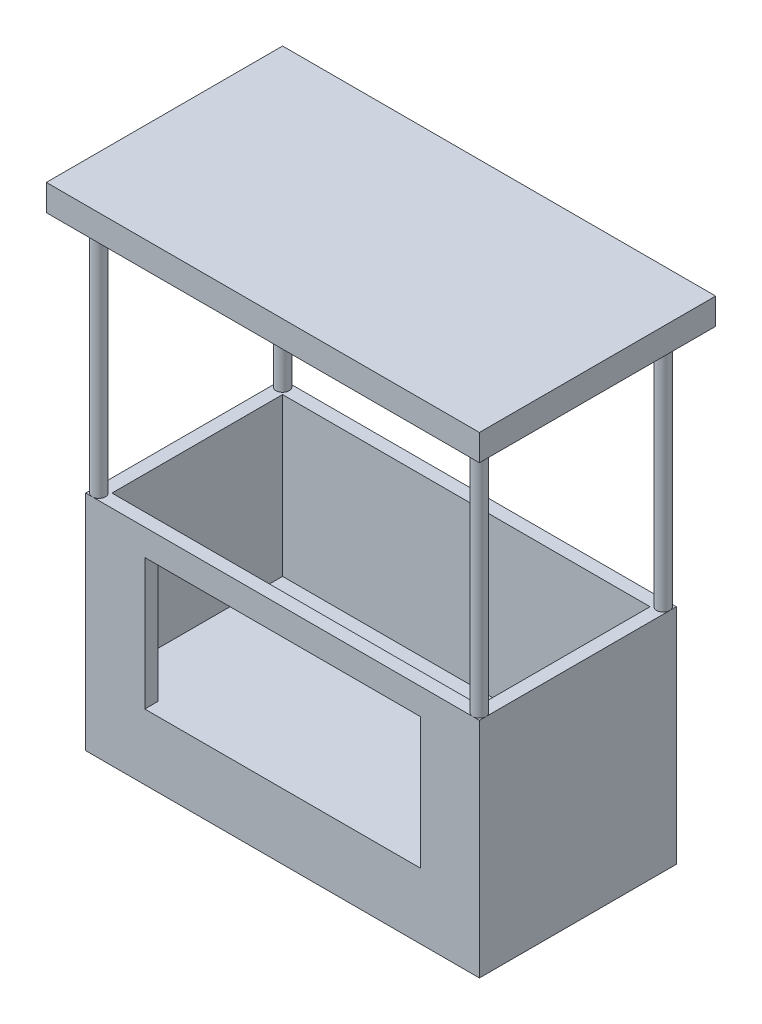
from build123d import *

# Parameters (mm, degrees)
SKETCH_1_W          = 60
SKETCH_1_H          = 30
EXTRUDE_1_DEPTH     = 10
EXTRUDE_2_DEPTH     = 20
SKETCH_3_W          = 60
SKETCH_3_H          = 30
SKETCH_3_W_2        = 56
SKETCH_3_H_2        = 26
EXTRUDE_3_DEPTH     = 4
SKETCH_4_R          = 1
EXTRUDE_4_DEPTH     = 37
SKETCH_5_W          = 66
SKETCH_5_H          = 36
EXTRUDE_5_DEPTH     = 4
CUT_EXTRUDE_1_REACH = 98.348
SKETCH_6_R          = 5


with BuildPart() as part:
    # 草图1 → 凸台-拉伸1 (new body)
    with BuildSketch(Plane(origin=(0, 0, 0), x_dir=(1, 0, 0), z_dir=(0, 1, 0))):
        with Locations((30, 15)):
            Rectangle(SKETCH_1_W, SKETCH_1_H)
    extrude(amount=EXTRUDE_1_DEPTH)

    # 草图2 → 凸台-拉伸2 (add)
    with BuildSketch(Plane(origin=(0, 10, 0), x_dir=(1, 0, 0), z_dir=(0, 1, 0))):
        Polygon((60, 0), (51, 0), (51, 2), (58, 2), (58, 28), (2, 28), (2, 2), (9, 2), (9, 0), (0, 0), (0, 30), (60, 30), align=None)
    extrude(amount=EXTRUDE_2_DEPTH)

    # 草图3 → 凸台-拉伸3 (add)
    with BuildSketch(Plane(origin=(0, 30, 0), x_dir=(1, 0, 0), z_dir=(0, 1, 0))):
        with Locations((30, 15)):
            Rectangle(SKETCH_3_W, SKETCH_3_H)
        with Locations((30, 15)):
            Rectangle(SKETCH_3_W_2, SKETCH_3_H_2, mode=Mode.SUBTRACT)
    extrude(amount=EXTRUDE_3_DEPTH)

    # 草图4 → 凸台-拉伸4 (add)
    with BuildSketch(Plane(origin=(0, 34, 0), x_dir=(1, 0, 0), z_dir=(0, 1, 0))):
        with Locations(Location((1, 29, 0), (0, 0, 90))):
            Circle(SKETCH_4_R)
        with Locations(Location((1, 1, 0), (0, 0, 270))):
            Circle(SKETCH_4_R)
        with Locations(Location((59, 29, 0), (0, 0, 90))):
            Circle(SKETCH_4_R)
        with Locations(Location((59, 1, 0), (0, 0, 270))):
            Circle(SKETCH_4_R)
    extrude(amount=EXTRUDE_4_DEPTH)

    # 草图5 → 凸台-拉伸5 (add)
    with BuildSketch(Plane(origin=(0, 71, 0), x_dir=(1, 0, 0), z_dir=(0, 1, 0))):
        with Locations((30, 15)):
            Rectangle(SKETCH_5_W, SKETCH_5_H)
    extrude(amount=EXTRUDE_5_DEPTH)

    # 草图6 → 切除-拉伸1 (cut, up to next)
    with BuildSketch(Plane(origin=(0, 10, 0), x_dir=(1, 0, 0), z_dir=(0, 1, 0)), mode=Mode.PRIVATE) as cut_extrude_1_sk1:
        with Locations(Location((52.583011954, 22.907401762, 0), (0, 0, 270))):
            Circle(SKETCH_6_R)
    cut_extrude_1_tool1 = extrude(cut_extrude_1_sk1.sketch, amount=-CUT_EXTRUDE_1_REACH, mode=Mode.PRIVATE) & part.part
    add(cut_extrude_1_tool1.solids().sort_by_distance((52.583012, 10, -22.907402))[0], mode=Mode.SUBTRACT)


solid = part.part
